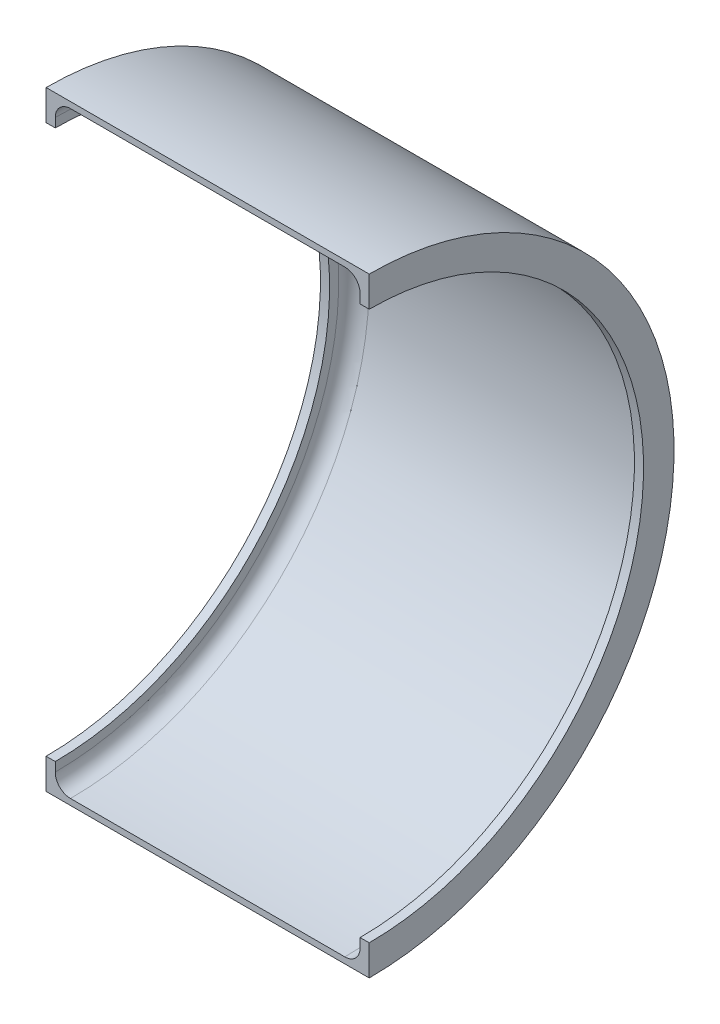
from build123d import *

# Parameters (mm, degrees)
SKETCH_1_W             = 100
SKETCH_1_H             = 2
REVOLVE_1_ANGLE        = 180
SKETCH_3_W             = 3
SKETCH_3_H             = 10
REVOLVE_2_ANGLE        = 180
FILLET_1_R             = 5
FILLET_1_OF_MIRROR_1_R = 5


with BuildPart() as part:
    # ｽｹｯﾁ1 → 回転1 (revolve)
    with BuildSketch(Plane.XY):
        with Locations((0, 99)):
            Rectangle(SKETCH_1_W, SKETCH_1_H)
    revolve(axis=Axis((-50, 0, 0), (-1, 0, 0)), revolution_arc=REVOLVE_1_ANGLE)

    # ｽｹｯﾁ3 → 回転2 (revolve)
    with BuildSketch(Plane.XY):
        with Locations((51.5, 95)):
            Rectangle(SKETCH_3_W, SKETCH_3_H)
    revolve_2 = revolve(axis=Axis((-50, 0, 0), (-1, 0, 0)), revolution_arc=REVOLVE_2_ANGLE)

    # ﾌｨﾚｯﾄ1
    fillet_1_edges = [part.edges().sort_by_distance(p)[0] for p in [
        (50, 0, -98),
    ]]
    fillet(fillet_1_edges, radius=FILLET_1_R)

    # ﾐﾗｰ1: 回転2 across plane
    add(revolve_2.mirror(Plane(origin=(0, 0, 0), x_dir=(0, 0, 1), z_dir=(1, 0, 0))))

    # ﾌｨﾚｯﾄ1 of ﾐﾗｰ1
    fillet_1_of_mirror_1_edges = [part.edges().sort_by_distance(p)[0] for p in [
        (-50, 0, -98),
    ]]
    fillet(fillet_1_of_mirror_1_edges, radius=FILLET_1_OF_MIRROR_1_R)


solid = part.part
